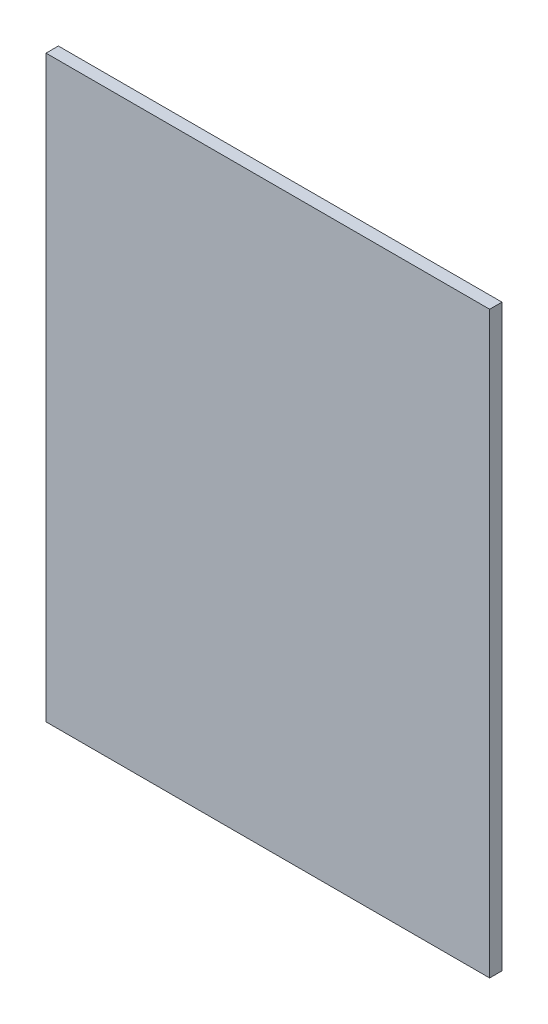
from build123d import *

# Parameters (mm, degrees)
SKETCH_1_W      = 36
SKETCH_1_H      = 47
EXTRUDE_1_DEPTH = 1


with BuildPart() as part:
    # ｽｹｯﾁ1 → ﾎﾞｽ - 押し出し1 (new body)
    with BuildSketch(Plane.XY):
        with Locations((18, 23.5)):
            Rectangle(SKETCH_1_W, SKETCH_1_H)
    extrude(amount=EXTRUDE_1_DEPTH)


solid = part.part
